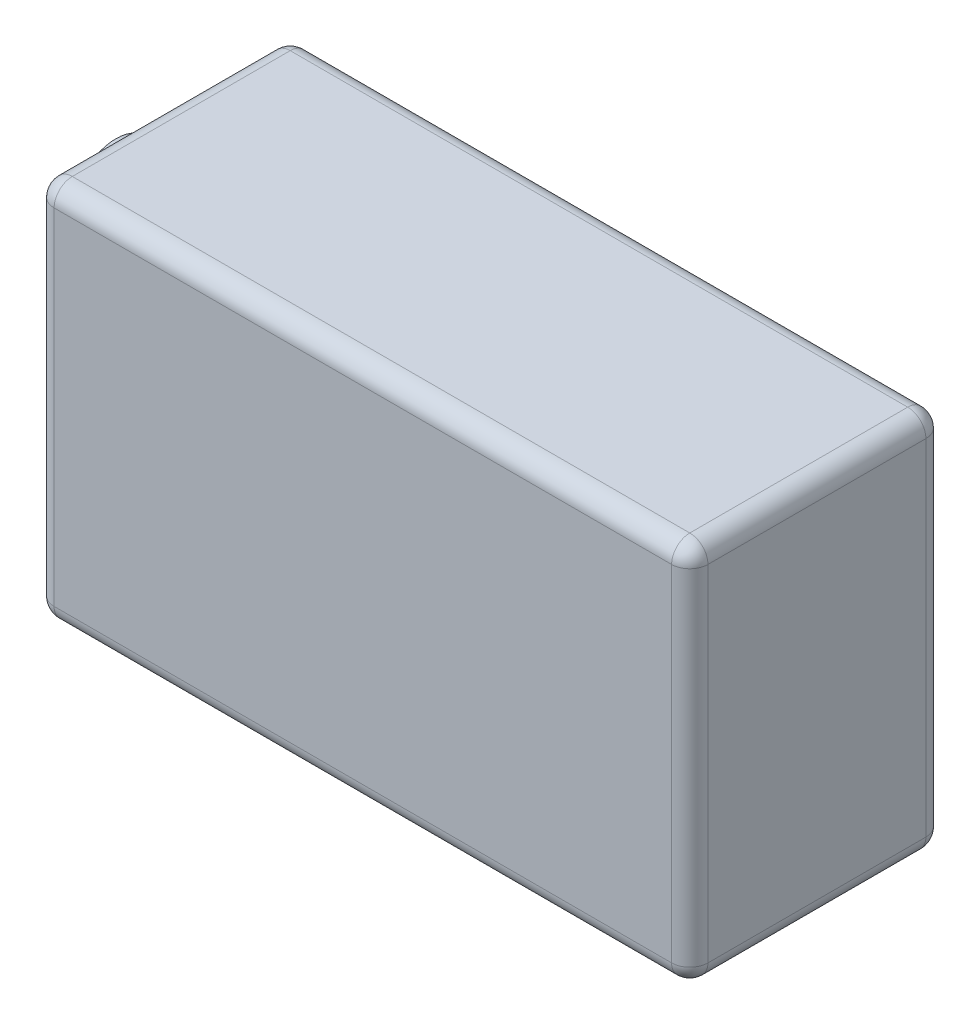
from build123d import *

# Parameters (mm, degrees)
SKETCH1_W           = 45.72
SKETCH1_H           = 26.67
BOSS_EXTRUDE1_DEPTH = 17.78
FILLET1_R           = 1.27
SKETCH2_R           = 2.9845
SKETCH2_R_2         = 4.0005
BOSS_EXTRUDE2_DEPTH = 3.302


with BuildPart() as part:
    # Sketch1 → Boss-Extrude1 (new body)
    with BuildSketch(Plane.XY):
        Rectangle(SKETCH1_W, SKETCH1_H)
    extrude(amount=BOSS_EXTRUDE1_DEPTH)

    # Fillet1
    fillet1_edges = [part.edges().sort_by_distance(p)[0] for p in [
        (-22.86, 0, 17.78),
        (0, -13.335, 17.78),
        (22.86, 0, 17.78),
        (0, -13.335, 0),
        (-22.86, 0, 0),
        (0, 13.335, 0),
        (22.86, 0, 0),
        (0, 13.335, 17.78),
        (22.86, -13.335, 8.89),
        (-22.86, -13.335, 8.89),
        (-22.86, 13.335, 8.89),
        (22.86, 13.335, 8.89),
    ]]
    fillet(fillet1_edges, radius=FILLET1_R)

    # Sketch2 → Boss-Extrude2 (add)
    with BuildSketch(Plane.ZY.offset(22.86)):
        with Locations(Location((8.89, 6.5405, 0), (0, 0, 90))):
            Circle(SKETCH2_R)
        with Locations(Location((8.89, -5.8801, 0), (0, 0, 90))):
            Circle(SKETCH2_R_2)
    extrude(amount=BOSS_EXTRUDE2_DEPTH)


solid = part.part
